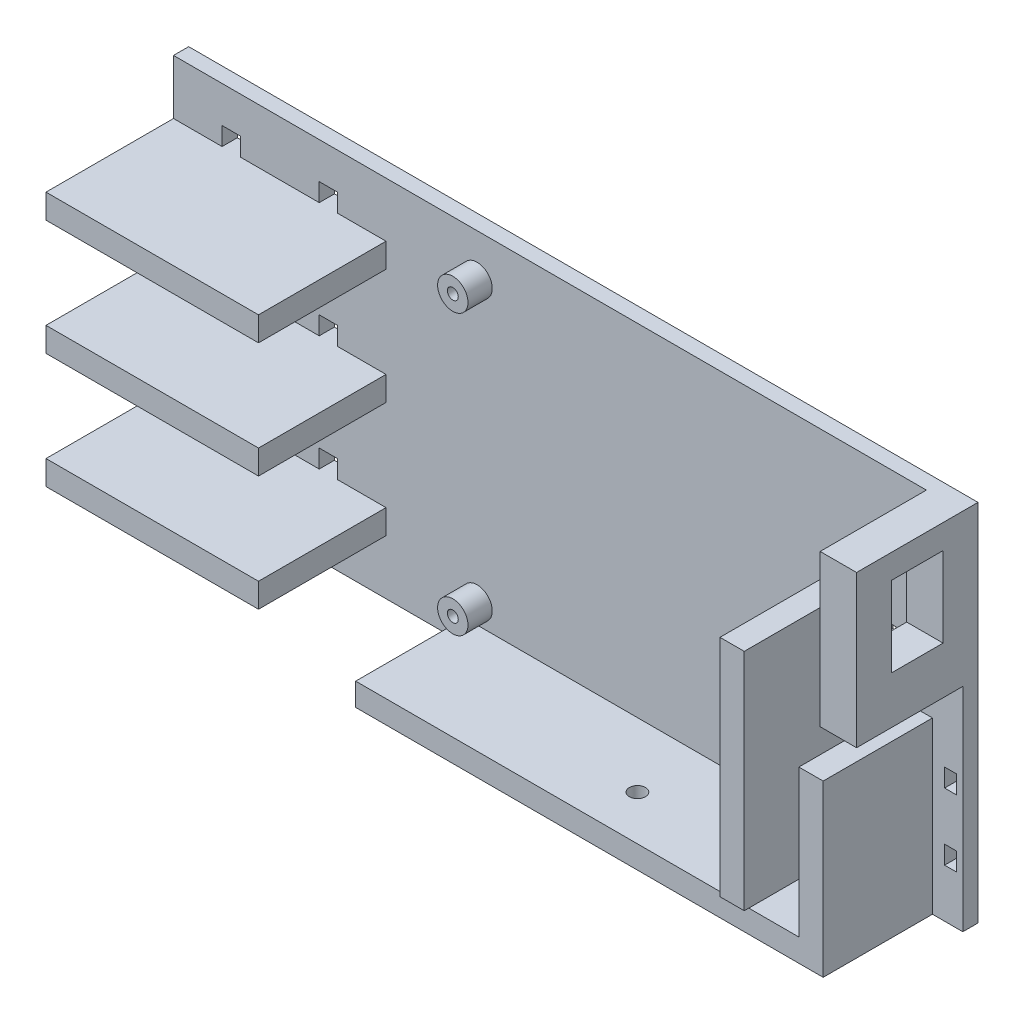
from build123d import *

# Parameters (mm, degrees)
SKETCH1_W           = 130
SKETCH1_H           = 60
BOSS_EXTRUDE1_DEPTH = 2.5
SKETCH2_R           = 2.5
BOSS_EXTRUDE2_DEPTH = 4
SKETCH3_W           = 4
SKETCH3_H           = 37
BOSS_EXTRUDE3_DEPTH = 20
SKETCH4_W           = 4
SKETCH4_H           = 28
BOSS_EXTRUDE4_DEPTH = 18
SKETCH5_R           = 0.9
CUT_EXTRUDE1_DEPTH  = 145.069427708
SKETCH6_W           = 3
SKETCH6_H           = 3
SKETCH6_W_2         = 1.5
SKETCH6_W_3         = 2
CUT_EXTRUDE2_DEPTH  = 145.568322948
SKETCH7_W           = 20
SKETCH7_H           = 25
SKETCH7_W_2         = 8.5
SKETCH7_H_2         = 13.2
BOSS_EXTRUDE5_DEPTH = 6
SKETCH8_W           = 35
SKETCH8_H           = 4
BOSS_EXTRUDE6_DEPTH = 21
SKETCH9_W           = 3
SKETCH9_H           = 3
SKETCH9_W_2         = 2.5
CUT_EXTRUDE3_DEPTH  = 145.710054937
SKETCH11_W          = 77
SKETCH11_H          = 20.5
BOSS_EXTRUDE8_DEPTH = 3.75
SKETCH12_R          = 1.325
CUT_EXTRUDE4_DEPTH  = 146.09393509


with BuildPart() as part:
    # Sketch1 → Boss-Extrude1 (new body)
    with BuildSketch(Plane.XY):
        with Locations((65, 30)):
            Rectangle(SKETCH1_W, SKETCH1_H)
    extrude(amount=BOSS_EXTRUDE1_DEPTH)

    # Sketch2 → Boss-Extrude2 (add)
    with BuildSketch(Plane.XY.offset(2.5)):
        with Locations(Location((50, 7, 0), (0, 0, 180))):
            Circle(SKETCH2_R)
        with Locations(Location((105, 7, 0), (0, 0, 180))):
            Circle(SKETCH2_R)
        with Locations(Location((50, 53, 0), (0, 0, 180))):
            Circle(SKETCH2_R)
    extrude(amount=BOSS_EXTRUDE2_DEPTH)

    # Sketch3 → Boss-Extrude3 (add)
    with BuildSketch(Plane.XY.offset(2.5)):
        with Locations((112, 23.5)):
            Rectangle(SKETCH3_W, SKETCH3_H)
    extrude(amount=BOSS_EXTRUDE3_DEPTH)

    # Sketch4 → Boss-Extrude4 (add)
    with BuildSketch(Plane.XY.offset(2.5)):
        with Locations((123, 14)):
            Rectangle(SKETCH4_W, SKETCH4_H)
    extrude(amount=BOSS_EXTRUDE4_DEPTH)

    # Sketch5 → Cut-Extrude1 (cut, through all)
    with BuildSketch(Plane.XY.offset(6.5)):
        with Locations((105, 7)):
            Circle(SKETCH5_R)
        with Locations((50, 7)):
            Circle(SKETCH5_R)
        with Locations((50, 53)):
            Circle(SKETCH5_R)
    extrude(amount=-CUT_EXTRUDE1_DEPTH, mode=Mode.SUBTRACT)

    # Sketch6 → Cut-Extrude2 (cut, through all)
    with BuildSketch(Plane.XY.offset(2.5)):
        with Locations((108.5, 36.5)):
            Rectangle(SKETCH6_W, SKETCH6_H)
        with Locations((108.5, 9.5)):
            Rectangle(SKETCH6_W, SKETCH6_H)
        with Locations((120.25, 20.5)):
            Rectangle(SKETCH6_W_2, SKETCH6_H)
        with Locations((128, 20.5)):
            Rectangle(SKETCH6_W_3, SKETCH6_H)
        with Locations((128, 9.5)):
            Rectangle(SKETCH6_W_3, SKETCH6_H)
        with Locations((120.25, 9.5)):
            Rectangle(SKETCH6_W_2, SKETCH6_H)
        with Locations((117, 9.5)):
            Rectangle(SKETCH6_W_3, SKETCH6_H)
        with Locations((117.5, 36.5)):
            Rectangle(SKETCH6_W, SKETCH6_H)
    extrude(amount=-CUT_EXTRUDE2_DEPTH, mode=Mode.SUBTRACT)

    # Sketch7 → Boss-Extrude5 (add)
    with BuildSketch(Plane(origin=(130, 0, 0), x_dir=(0, 0, -1), z_dir=(1, 0, 0))):
        with Locations((-10, 47.5)):
            Rectangle(SKETCH7_W, SKETCH7_H)
        with Locations((-10, 49.4)):
            Rectangle(SKETCH7_W_2, SKETCH7_H_2, mode=Mode.SUBTRACT)
    extrude(amount=-BOSS_EXTRUDE5_DEPTH)

    # Sketch8 → Boss-Extrude6 (add)
    with BuildSketch(Plane.XY.offset(2.5)):
        with Locations((17.5, 49)):
            Rectangle(SKETCH8_W, SKETCH8_H)
        with Locations((17.5, 30)):
            Rectangle(SKETCH8_W, SKETCH8_H)
        with Locations((17.5, 11)):
            Rectangle(SKETCH8_W, SKETCH8_H)
    extrude(amount=BOSS_EXTRUDE6_DEPTH)

    # Sketch9 → Cut-Extrude3 (cut, through all)
    with BuildSketch(Plane.XY.offset(2.5)):
        with Locations((9.5, 14.5)):
            Rectangle(SKETCH9_W, SKETCH9_H)
        with Locations((25.5, 14.5)):
            Rectangle(SKETCH9_W, SKETCH9_H)
        with Locations((9.5, 33.5)):
            Rectangle(SKETCH9_W, SKETCH9_H)
        with Locations((25.5, 33.5)):
            Rectangle(SKETCH9_W, SKETCH9_H)
        with Locations((9.5, 52.5)):
            Rectangle(SKETCH9_W, SKETCH9_H)
        with Locations((25.5, 52.5)):
            Rectangle(SKETCH9_W, SKETCH9_H)
        with Locations((9.25, 5.5)):
            Rectangle(SKETCH9_W_2, SKETCH9_H)
        with Locations((9.25, 24.5)):
            Rectangle(SKETCH9_W_2, SKETCH9_H)
        with Locations((25.5, 24.5)):
            Rectangle(SKETCH9_W, SKETCH9_H)
        with Locations((25.5, 5.5)):
            Rectangle(SKETCH9_W, SKETCH9_H)
        with Locations((25.5, 43.5)):
            Rectangle(SKETCH9_W, SKETCH9_H)
        with Locations((9.25, 43.5)):
            Rectangle(SKETCH9_W_2, SKETCH9_H)
    extrude(amount=-CUT_EXTRUDE3_DEPTH, mode=Mode.SUBTRACT)

    # Sketch11 → Boss-Extrude8 (add)
    with BuildSketch(Plane.XZ):
        with Locations((86.5, 10.25)):
            Rectangle(SKETCH11_W, SKETCH11_H)
    extrude(amount=-BOSS_EXTRUDE8_DEPTH)

    # Sketch12 → Cut-Extrude4 (cut, through all)
    with BuildSketch(Plane.XZ):
        with Locations(Location((87.03, 13.12, 0), (0, 0, 270))):
            Circle(SKETCH12_R)
    extrude(amount=-CUT_EXTRUDE4_DEPTH, mode=Mode.SUBTRACT)


solid = part.part
